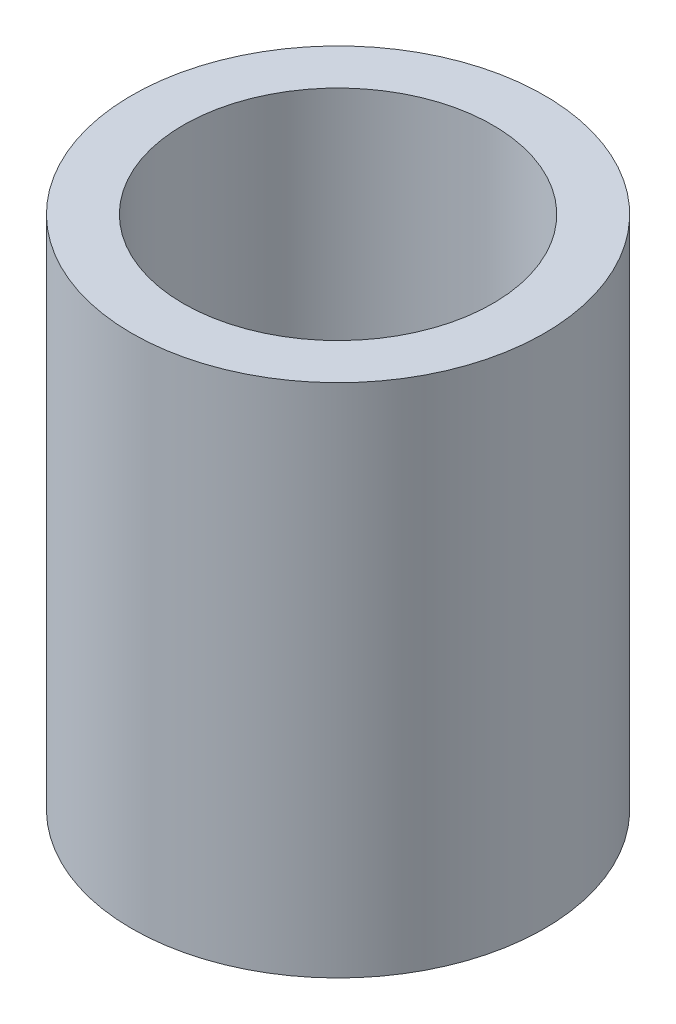
from build123d import *

# Parameters (mm, degrees)
SKETCH1_R           = 16
SKETCH1_R_2         = 12
BOSS_EXTRUDE1_DEPTH = 20


with BuildPart() as part:
    # Sketch1 → Boss-Extrude1 (new, symmetric)
    with BuildSketch(Plane(origin=(0, 0, 0), x_dir=(1, 0, 0), z_dir=(0, 1, 0))):
        with Locations(Location((0, 0, 0), (0, 0, 270))):
            Circle(SKETCH1_R)
        with Locations(Location((0, 0, 0), (0, 0, 270))):
            Circle(SKETCH1_R_2, mode=Mode.SUBTRACT)
    extrude(amount=BOSS_EXTRUDE1_DEPTH, both=True)


solid = part.part
